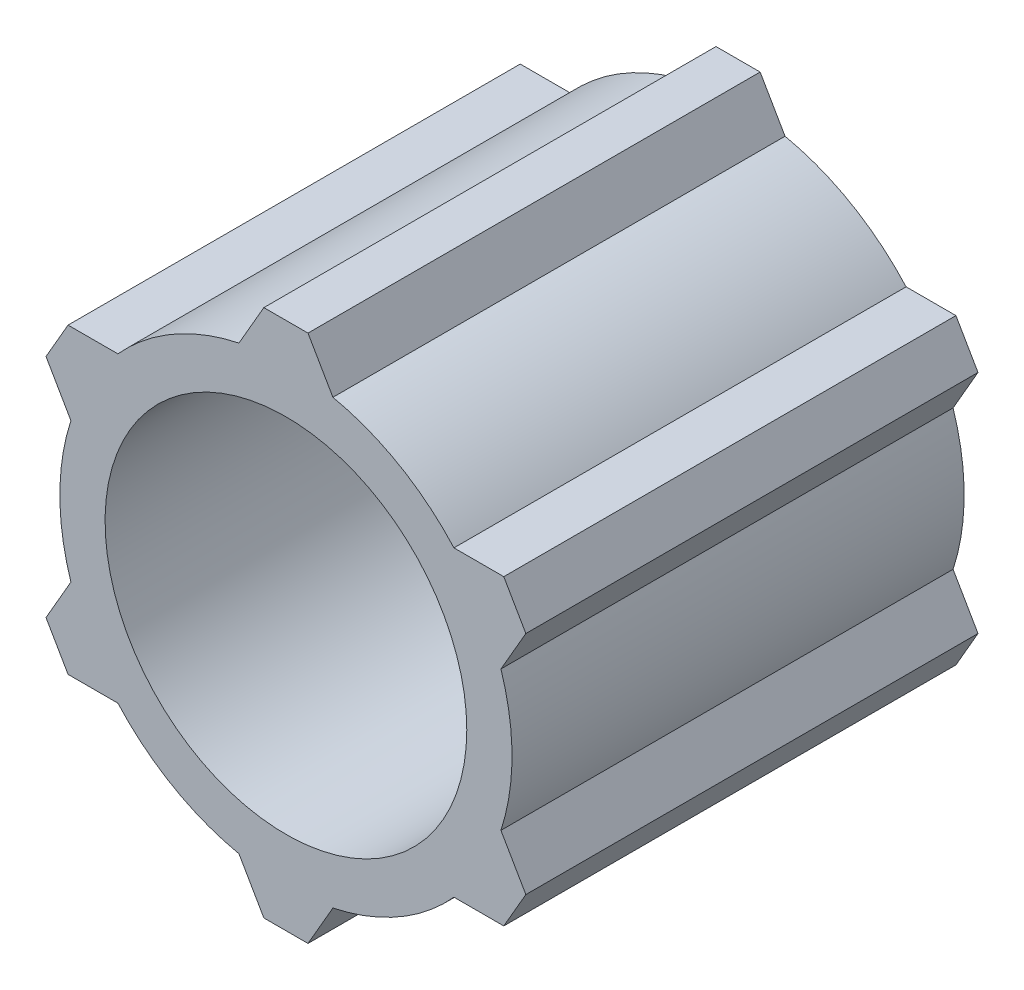
from build123d import *
from build123d.topology import SkipClean

# Parameters (mm, degrees)
SKETCH2_R           = 2.5
BOSS_EXTRUDE2_DEPTH = 5
SKETCH3_R           = 20
BOSS_EXTRUDE3_DEPTH = 45


with BuildPart() as part:
    # Sketch2 → Boss-Extrude2 (new body)
    with BuildSketch(Plane.XY):
        with BuildLine():
            ThreePointArc((-5.195852071, 24.45410234), (-12.5, 21.650635095), (-18.579947817, 16.726791058))
            Line((-18.579947817, 16.726791058), (-24.09097405, 16.726791058))
            Line((-24.09097405, 16.726791058), (-26.531313005, 12.5))
            Line((-26.531313005, 12.5), (-23.775799889, 7.727311282))
            ThreePointArc((-23.775799889, 7.727311282), (-25, 0), (-23.775799889, -7.727311282))
            Line((-23.775799889, -7.727311282), (-26.531313005, -12.5))
            Line((-26.531313005, -12.5), (-24.09097405, -16.726791058))
            Line((-24.09097405, -16.726791058), (-18.579947817, -16.726791058))
            ThreePointArc((-18.579947817, -16.726791058), (-12.5, -21.650635095), (-5.195852071, -24.45410234))
            Line((-5.195852071, -24.45410234), (-2.440338955, -29.226791058))
            Line((-2.440338955, -29.226791058), (2.440338955, -29.226791058))
            Line((2.440338955, -29.226791058), (5.195852071, -24.45410234))
            ThreePointArc((5.195852071, -24.45410234), (12.5, -21.650635095), (18.579947817, -16.726791058))
            Line((18.579947817, -16.726791058), (24.09097405, -16.726791058))
            Line((24.09097405, -16.726791058), (26.531313005, -12.5))
            Line((26.531313005, -12.5), (23.775799889, -7.727311282))
            ThreePointArc((23.775799889, -7.727311282), (25, 0), (23.775799889, 7.727311282))
            Line((23.775799889, 7.727311282), (26.531313005, 12.5))
            Line((26.531313005, 12.5), (24.09097405, 16.726791058))
            Line((24.09097405, 16.726791058), (18.579947817, 16.726791058))
            ThreePointArc((18.579947817, 16.726791058), (12.5, 21.650635095), (5.195852071, 24.45410234))
            Line((5.195852071, 24.45410234), (2.440338955, 29.226791058))
            Line((2.440338955, 29.226791058), (-2.440338955, 29.226791058))
            Line((-2.440338955, 29.226791058), (-5.195852071, 24.45410234))
        make_face()
        with BuildLine():
            Line((-16.521725449, -11.270873443), (-3.38067791, -3.683886109))
            ThreePointArc((-3.38067791, -3.683886109), (-2.5, -4.330127019), (-1.5, -4.769696007))
            Line((-1.5, -4.769696007), (-1.5, -19.943670675))
            ThreePointArc((-1.5, -19.943670675), (-10, -17.320508076), (-16.521725449, -11.270873443))
        make_face(mode=Mode.SUBTRACT)
        with BuildLine():
            Line((-18.021725449, 8.672797232), (-4.88067791, 1.085809898))
            ThreePointArc((-4.88067791, 1.085809898), (-5, 0), (-4.88067791, -1.085809898))
            Line((-4.88067791, -1.085809898), (-18.021725449, -8.672797232))
            ThreePointArc((-18.021725449, -8.672797232), (-20, 0), (-18.021725449, 8.672797232))
        make_face(mode=Mode.SUBTRACT)
        with BuildLine():
            Line((1.5, -19.943670675), (1.5, -4.769696007))
            ThreePointArc((1.5, -4.769696007), (2.5, -4.330127019), (3.38067791, -3.683886109))
            Line((3.38067791, -3.683886109), (16.521725449, -11.270873443))
            ThreePointArc((16.521725449, -11.270873443), (10, -17.320508076), (1.5, -19.943670675))
        make_face(mode=Mode.SUBTRACT)
        with BuildLine():
            Line((-1.5, 19.943670675), (-1.5, 4.769696007))
            ThreePointArc((-1.5, 4.769696007), (-2.5, 4.330127019), (-3.38067791, 3.683886109))
            Line((-3.38067791, 3.683886109), (-16.521725449, 11.270873443))
            ThreePointArc((-16.521725449, 11.270873443), (-10, 17.320508076), (-1.5, 19.943670675))
        make_face(mode=Mode.SUBTRACT)
        Circle(SKETCH2_R, mode=Mode.SUBTRACT)
        with BuildLine():
            Line((18.021725449, -8.672797232), (4.88067791, -1.085809898))
            ThreePointArc((4.88067791, -1.085809898), (5, 0), (4.88067791, 1.085809898))
            Line((4.88067791, 1.085809898), (18.021725449, 8.672797232))
            ThreePointArc((18.021725449, 8.672797232), (20, 0), (18.021725449, -8.672797232))
        make_face(mode=Mode.SUBTRACT)
        with BuildLine():
            Line((16.521725449, 11.270873443), (3.38067791, 3.683886109))
            ThreePointArc((3.38067791, 3.683886109), (2.5, 4.330127019), (1.5, 4.769696007))
            Line((1.5, 4.769696007), (1.5, 19.943670675))
            ThreePointArc((1.5, 19.943670675), (10, 17.320508076), (16.521725449, 11.270873443))
        make_face(mode=Mode.SUBTRACT)
    extrude(amount=BOSS_EXTRUDE2_DEPTH)

    # Sketch3 → Boss-Extrude3 (add)
    with SkipClean():  # the faces are left unmerged after this step: merging them gives an invalid solid
        with BuildSketch(Plane.XY.offset(5)):
            with BuildLine():
                Line((-2.440338955, 29.226791058), (-5.195852071, 24.45410234))
                ThreePointArc((-5.195852071, 24.45410234), (-12.5, 21.650635095), (-18.579947817, 16.726791058))
                Line((-18.579947817, 16.726791058), (-24.09097405, 16.726791058))
                Line((-24.09097405, 16.726791058), (-26.531313005, 12.5))
                Line((-26.531313005, 12.5), (-23.775799889, 7.727311282))
                ThreePointArc((-23.775799889, 7.727311282), (-25, 0), (-23.775799889, -7.727311282))
                Line((-23.775799889, -7.727311282), (-26.531313005, -12.5))
                Line((-26.531313005, -12.5), (-24.09097405, -16.726791058))
                Line((-24.09097405, -16.726791058), (-18.579947817, -16.726791058))
                ThreePointArc((-18.579947817, -16.726791058), (-12.5, -21.650635095), (-5.195852071, -24.45410234))
                Line((-5.195852071, -24.45410234), (-2.440338955, -29.226791058))
                Line((-2.440338955, -29.226791058), (2.440338955, -29.226791058))
                Line((2.440338955, -29.226791058), (5.195852071, -24.45410234))
                ThreePointArc((5.195852071, -24.45410234), (12.5, -21.650635095), (18.579947817, -16.726791058))
                Line((18.579947817, -16.726791058), (24.09097405, -16.726791058))
                Line((24.09097405, -16.726791058), (26.531313005, -12.5))
                Line((26.531313005, -12.5), (23.775799889, -7.727311282))
                ThreePointArc((23.775799889, -7.727311282), (25, 0), (23.775799889, 7.727311282))
                Line((23.775799889, 7.727311282), (26.531313005, 12.5))
                Line((26.531313005, 12.5), (24.09097405, 16.726791058))
                Line((24.09097405, 16.726791058), (18.579947817, 16.726791058))
                ThreePointArc((18.579947817, 16.726791058), (12.5, 21.650635095), (5.195852071, 24.45410234))
                Line((5.195852071, 24.45410234), (2.440338955, 29.226791058))
                Line((2.440338955, 29.226791058), (-2.440338955, 29.226791058))
            make_face()
            with Locations(Location((0, 0, 0), (0, 0, 154.301222305))):
                Circle(SKETCH3_R, mode=Mode.SUBTRACT)
        extrude(amount=BOSS_EXTRUDE3_DEPTH)


solid = part.part
